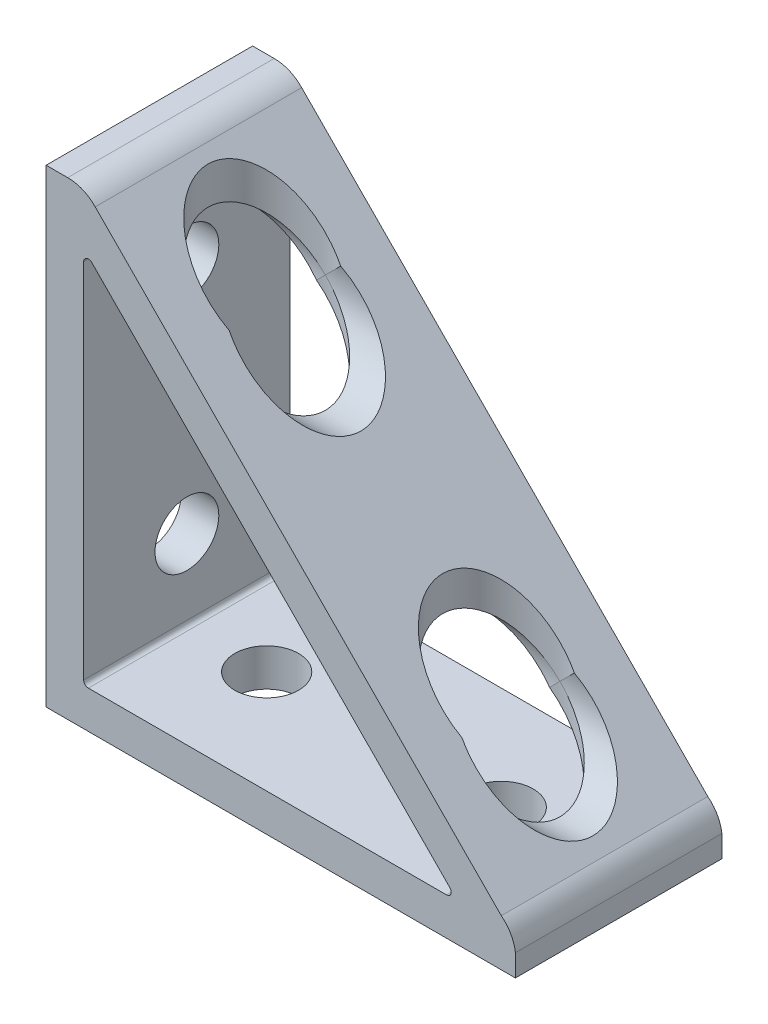
from build123d import *

# Parameters (mm, degrees)
EXTRUDE1_DEPTH     = 22
CUT_EXTRUDE1_DEPTH = 75.054034
CUT_EXTRUDE2_REACH = 76.054
SKETCH5_R          = 6.25
CUT_EXTRUDE3_DEPTH = 75.054186
CUT_EXTRUDE4_REACH = 76.054
SKETCH7_R          = 6.25


with BuildPart() as part:
    # Sketch1 → Extrude1 (new body)
    with BuildSketch(Plane.XY):
        with BuildLine():
            Line((0, 0), (50, 0))
            Line((50, 0), (50, 2.331245))
            ThreePointArc((50, 2.331245), (49.515156, 3.811364), (48.501771, 4.994104))
            Line((48.501771, 4.994104), (5.229403, 48.768941))
            ThreePointArc((5.229403, 48.768941), (3.892255, 49.687806), (2.300146, 50))
            Line((2.300146, 50), (0, 50))
            Line((0, 50), (0, 0))
        make_face()
        with BuildLine():
            Line((4, 43.105797), (4, 4.5))
            ThreePointArc((4, 4.5), (4.146447, 4.146447), (4.5, 4))
            Line((4.5, 4), (42.662662, 4))
            ThreePointArc((42.662662, 4), (43.124047, 4.307326), (43.01825, 4.851507))
            Line((43.01825, 4.851507), (4.855588, 43.457304))
            ThreePointArc((4.855588, 43.457304), (4.309992, 43.568287), (4, 43.105797))
        make_face(mode=Mode.SUBTRACT)
    extrude(amount=EXTRUDE1_DEPTH)

    # Sketch4 → Cut-Extrude1 (cut, through all)
    with BuildSketch(Plane(origin=(0, 50, 0), x_dir=(1, 0, 0), z_dir=(0, 1, 0))):
        with BuildLine():
            ThreePointArc((12.5, -7.6), (9.1, -11), (12.5, -14.4))
            Line((12.5, -14.4), (12.5, -7.6))
        make_face()
        with BuildLine():
            Line((12.5, -7.6), (12.5, -14.4))
            ThreePointArc((12.5, -14.4), (14.904163, -13.404163), (15.9, -11))
            ThreePointArc((15.9, -11), (14.904163, -8.595837), (12.5, -7.6))
        make_face()
        with BuildLine():
            ThreePointArc((37.5, -7.6), (34.1, -11), (37.5, -14.4))
            Line((37.5, -14.4), (37.5, -7.6))
        make_face()
        with BuildLine():
            Line((37.5, -7.6), (37.5, -14.4))
            ThreePointArc((37.5, -14.4), (39.904163, -13.404163), (40.9, -11))
            ThreePointArc((40.9, -11), (39.904163, -8.595837), (37.5, -7.6))
        make_face()
    extrude(amount=-CUT_EXTRUDE1_DEPTH, mode=Mode.SUBTRACT)

    # Cut-Extrude2: up to this face of the body (flat: up to its plane)
    cut_extrude2_end = Plane(part.part.faces().sort_by_distance((23.446976, 4, 11))[0])
    # Sketch5 → Cut-Extrude2 (cut, up to the picked face)
    with BuildSketch(Plane(origin=(0, 50, 0), x_dir=(1, 0, 0), z_dir=(0, 1, 0)), mode=Mode.PRIVATE) as cut_extrude2_sk1:
        with Locations(Location((12.5, -11, 0), (0, 0, 180))):
            Circle(SKETCH5_R)
    cut_extrude2_tool1 = split(extrude(cut_extrude2_sk1.sketch, amount=-CUT_EXTRUDE2_REACH, mode=Mode.PRIVATE), bisect_by=cut_extrude2_end, keep=Keep.BOTH, mode=Mode.PRIVATE)
    # Sketch5 → Cut-Extrude2 (cut, up to the picked face)
    with BuildSketch(Plane(origin=(0, 50, 0), x_dir=(1, 0, 0), z_dir=(0, 1, 0)), mode=Mode.PRIVATE) as cut_extrude2_sk2:
        with Locations(Location((37.5, -11, 0), (0, 0, 325.692636))):
            Circle(SKETCH5_R)
    cut_extrude2_tool2 = split(extrude(cut_extrude2_sk2.sketch, amount=-CUT_EXTRUDE2_REACH, mode=Mode.PRIVATE), bisect_by=cut_extrude2_end, keep=Keep.BOTH, mode=Mode.PRIVATE)
    add(cut_extrude2_tool1.solids().sort_by(Axis((12.5, 50, 11), (0, -1, 0)))[0], mode=Mode.SUBTRACT)
    add(cut_extrude2_tool2.solids().sort_by(Axis((37.5, 50, 11), (0, -1, 0)))[0], mode=Mode.SUBTRACT)

    # Sketch6 → Cut-Extrude3 (cut, through all)
    with BuildSketch(Plane(origin=(50, 0, 0), x_dir=(0, 0, -1), z_dir=(1, 0, 0))):
        with BuildLine():
            ThreePointArc((-7.6, 37.5), (-11, 40.9), (-14.4, 37.5))
            Line((-14.4, 37.5), (-7.6, 37.5))
        make_face()
        with BuildLine():
            Line((-7.6, 37.5), (-14.4, 37.5))
            ThreePointArc((-14.4, 37.5), (-11, 34.1), (-7.6, 37.5))
        make_face()
        with BuildLine():
            ThreePointArc((-7.6, 12.5), (-11, 15.9), (-14.4, 12.5))
            Line((-14.4, 12.5), (-7.6, 12.5))
        make_face()
        with BuildLine():
            Line((-7.6, 12.5), (-14.4, 12.5))
            ThreePointArc((-14.4, 12.5), (-11, 9.1), (-7.6, 12.5))
        make_face()
    extrude(amount=-CUT_EXTRUDE3_DEPTH, mode=Mode.SUBTRACT)

    # Cut-Extrude4: up to this face of the body (flat: up to its plane)
    cut_extrude4_end = Plane(part.part.faces().sort_by_distance((4, 23.69095, 11))[0])
    # Sketch7 → Cut-Extrude4 (cut, up to the picked face)
    with BuildSketch(Plane(origin=(50, 0, 0), x_dir=(0, 0, -1), z_dir=(1, 0, 0)), mode=Mode.PRIVATE) as cut_extrude4_sk1:
        with Locations((-11, 12.5)):
            Circle(SKETCH7_R)
    cut_extrude4_tool1 = split(extrude(cut_extrude4_sk1.sketch, amount=-CUT_EXTRUDE4_REACH, mode=Mode.PRIVATE), bisect_by=cut_extrude4_end, keep=Keep.BOTH, mode=Mode.PRIVATE)
    # Sketch7 → Cut-Extrude4 (cut, up to the picked face)
    with BuildSketch(Plane(origin=(50, 0, 0), x_dir=(0, 0, -1), z_dir=(1, 0, 0)), mode=Mode.PRIVATE) as cut_extrude4_sk2:
        with Locations((-11, 37.5)):
            Circle(SKETCH7_R)
    cut_extrude4_tool2 = split(extrude(cut_extrude4_sk2.sketch, amount=-CUT_EXTRUDE4_REACH, mode=Mode.PRIVATE), bisect_by=cut_extrude4_end, keep=Keep.BOTH, mode=Mode.PRIVATE)
    add(cut_extrude4_tool1.solids().sort_by(Axis((50, 12.5, 11), (-1, 0, 0)))[0], mode=Mode.SUBTRACT)
    add(cut_extrude4_tool2.solids().sort_by(Axis((50, 37.5, 11), (-1, 0, 0)))[0], mode=Mode.SUBTRACT)


solid = part.part
